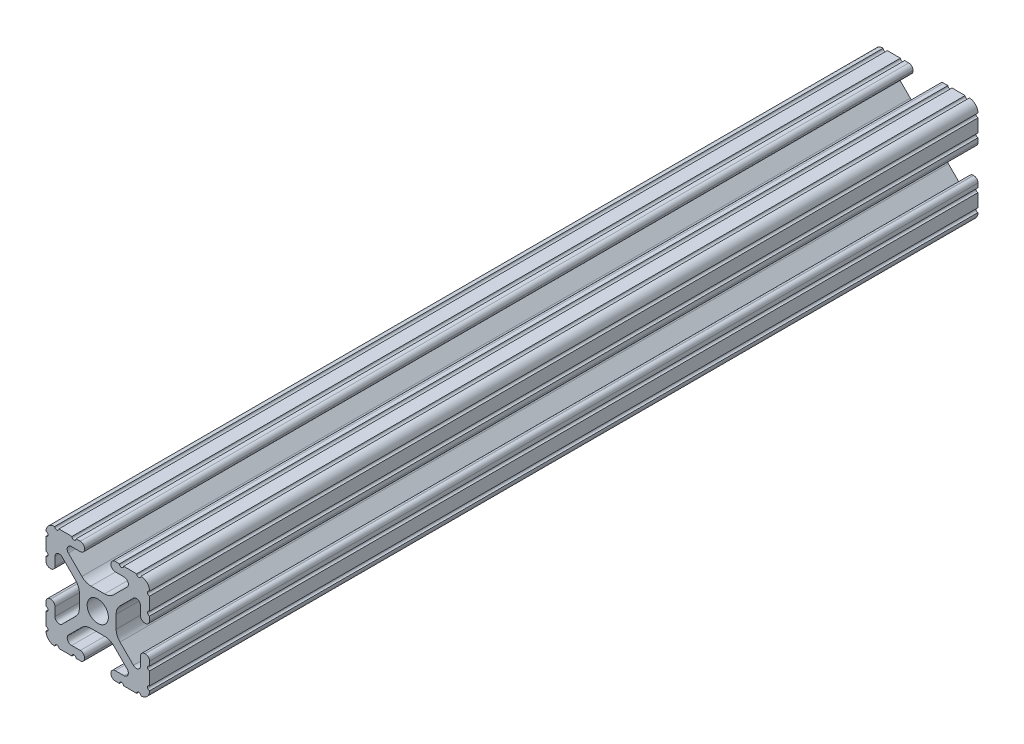
from build123d import *

# Parameters (mm, degrees)
SKETCH1_R      = 2.6035
EXTRUDE1_DEPTH = 203.2


with BuildPart() as part:
    # Sketch1 → Extrude1 (new body)
    with BuildSketch(Plane.XY):
        with BuildLine():
            Line((-7.207036008, 8.724370562), (-3.898272566, 5.423169045))
            ThreePointArc((-3.898272566, 5.423169045), (-2.869120213, 4.736787962), (-1.655778399, 4.4958))
            Line((-1.655778399, 4.4958), (1.655778399, 4.4958))
            ThreePointArc((1.655778399, 4.4958), (2.869120213, 4.736787962), (3.898272566, 5.423169045))
            Line((3.898272566, 5.423169045), (7.207036008, 8.724370562))
            ThreePointArc((7.207036008, 8.724370562), (7.432222385, 9.85140422), (6.476788598, 10.4902))
            Line((6.476788598, 10.4902), (4.287512407, 10.4902))
            ThreePointArc((4.287512407, 10.4902), (3.54574862, 10.79744862), (3.2385, 11.539212407))
            Line((3.2385, 11.539212407), (3.2385, 11.650987593))
            ThreePointArc((3.2385, 11.650987593), (3.54574862, 12.39275138), (4.287512407, 12.7))
            Line((4.287512407, 12.7), (5.317126718, 12.7))
            ThreePointArc((5.317126718, 12.7), (5.825126718, 12.192), (6.333126718, 12.7))
            Line((6.333126718, 12.7), (9.550443118, 12.7))
            ThreePointArc((9.550443118, 12.7), (10.058366869, 12.192000006), (10.566443095, 12.699847501))
            ThreePointArc((10.566443095, 12.699847501), (12.082537762, 12.08250727), (12.699846982, 10.566399977))
            ThreePointArc((12.699846982, 10.566399977), (12.192000006, 10.058323491), (12.7, 9.5504))
            Line((12.7, 9.5504), (12.7, 6.3330836))
            ThreePointArc((12.7, 6.3330836), (12.192, 5.8250836), (12.7, 5.3170836))
            Line((12.7, 5.3170836), (12.7, 4.287469289))
            ThreePointArc((12.7, 4.287469289), (12.39275138, 3.545705502), (11.650987593, 3.238456882))
            Line((11.650987593, 3.238456882), (11.539212407, 3.238456882))
            ThreePointArc((11.539212407, 3.238456882), (10.79744862, 3.545705502), (10.4902, 4.287469289))
            Line((10.4902, 4.287469289), (10.4902, 6.402089023))
            ThreePointArc((10.4902, 6.402089023), (9.856505071, 7.351067942), (8.737131347, 7.129408934))
            Line((8.737131347, 7.129408934), (5.441005833, 3.840816462))
            ThreePointArc((5.441005833, 3.840816462), (4.750877967, 2.809883091), (4.5085, 1.593185507))
            Line((4.5085, 1.593185507), (4.5085, -1.593185507))
            ThreePointArc((4.5085, -1.593185507), (4.750877967, -2.809883091), (5.441005833, -3.840816462))
            Line((5.441005833, -3.840816462), (8.737131347, -7.129408934))
            ThreePointArc((8.737131347, -7.129408934), (9.856505071, -7.351067942), (10.4902, -6.402089023))
            Line((10.4902, -6.402089023), (10.4902, -4.287469289))
            ThreePointArc((10.4902, -4.287469289), (10.79744862, -3.545705502), (11.539212407, -3.238456882))
            Line((11.539212407, -3.238456882), (11.650987593, -3.238456882))
            ThreePointArc((11.650987593, -3.238456882), (12.39275138, -3.545705502), (12.7, -4.287469289))
            Line((12.7, -4.287469289), (12.7, -5.3170836))
            ThreePointArc((12.7, -5.3170836), (12.192, -5.8250836), (12.7, -6.3330836))
            Line((12.7, -6.3330836), (12.7, -9.5504))
            ThreePointArc((12.7, -9.5504), (12.192000006, -10.058323491), (12.699846982, -10.566399977))
            ThreePointArc((12.699846982, -10.566399977), (12.082537762, -12.08250727), (10.566443095, -12.699847501))
            ThreePointArc((10.566443095, -12.699847501), (10.058366869, -12.192000006), (9.550443118, -12.7))
            Line((9.550443118, -12.7), (6.333126718, -12.7))
            ThreePointArc((6.333126718, -12.7), (5.825126718, -12.192), (5.317126718, -12.7))
            Line((5.317126718, -12.7), (4.287512407, -12.7))
            ThreePointArc((4.287512407, -12.7), (3.54574862, -12.39275138), (3.2385, -11.650987593))
            Line((3.2385, -11.650987593), (3.2385, -11.539212407))
            ThreePointArc((3.2385, -11.539212407), (3.54574862, -10.79744862), (4.287512407, -10.4902))
            Line((4.287512407, -10.4902), (6.416408329, -10.4902))
            ThreePointArc((6.416408329, -10.4902), (7.41473083, -9.822813117), (7.179650497, -8.645192506))
            Line((7.179650497, -8.645192506), (3.952270251, -5.423690499))
            ThreePointArc((3.952270251, -5.423690499), (2.922936451, -4.736929036), (1.709253557, -4.4958))
            Line((1.709253557, -4.4958), (-1.709253557, -4.4958))
            ThreePointArc((-1.709253557, -4.4958), (-2.922936451, -4.736929036), (-3.952270251, -5.423690499))
            Line((-3.952270251, -5.423690499), (-7.179650497, -8.645192506))
            ThreePointArc((-7.179650497, -8.645192506), (-7.41473083, -9.822813117), (-6.416408329, -10.4902))
            Line((-6.416408329, -10.4902), (-4.287512407, -10.4902))
            ThreePointArc((-4.287512407, -10.4902), (-3.54574862, -10.79744862), (-3.2385, -11.539212407))
            Line((-3.2385, -11.539212407), (-3.2385, -11.650987593))
            ThreePointArc((-3.2385, -11.650987593), (-3.54574862, -12.39275138), (-4.287512407, -12.7))
            Line((-4.287512407, -12.7), (-5.317126718, -12.7))
            ThreePointArc((-5.317126718, -12.7), (-5.825126718, -12.192), (-6.333126718, -12.7))
            Line((-6.333126718, -12.7), (-9.550443118, -12.7))
            ThreePointArc((-9.550443118, -12.7), (-10.058366869, -12.192000006), (-10.566443095, -12.699847501))
            ThreePointArc((-10.566443095, -12.699847501), (-12.082537762, -12.08250727), (-12.699846982, -10.566399977))
            ThreePointArc((-12.699846982, -10.566399977), (-12.192000006, -10.058323491), (-12.7, -9.5504))
            Line((-12.7, -9.5504), (-12.7, -6.3330836))
            ThreePointArc((-12.7, -6.3330836), (-12.192, -5.8250836), (-12.7, -5.3170836))
            Line((-12.7, -5.3170836), (-12.7, -4.287469289))
            ThreePointArc((-12.7, -4.287469289), (-12.39275138, -3.545705502), (-11.650987593, -3.238456882))
            Line((-11.650987593, -3.238456882), (-11.539212407, -3.238456882))
            ThreePointArc((-11.539212407, -3.238456882), (-10.79744862, -3.545705502), (-10.4902, -4.287469289))
            Line((-10.4902, -4.287469289), (-10.4902, -6.402089023))
            ThreePointArc((-10.4902, -6.402089023), (-9.856505071, -7.351067942), (-8.737131347, -7.129408934))
            Line((-8.737131347, -7.129408934), (-5.441005833, -3.840816462))
            ThreePointArc((-5.441005833, -3.840816462), (-4.750877967, -2.809883091), (-4.5085, -1.593185507))
            Line((-4.5085, -1.593185507), (-4.5085, 1.593185507))
            ThreePointArc((-4.5085, 1.593185507), (-4.750877967, 2.809883091), (-5.441005833, 3.840816462))
            Line((-5.441005833, 3.840816462), (-8.737131347, 7.129408934))
            ThreePointArc((-8.737131347, 7.129408934), (-9.856505071, 7.351067942), (-10.4902, 6.402089023))
            Line((-10.4902, 6.402089023), (-10.4902, 4.287469289))
            ThreePointArc((-10.4902, 4.287469289), (-10.79744862, 3.545705502), (-11.539212407, 3.238456882))
            Line((-11.539212407, 3.238456882), (-11.650987593, 3.238456882))
            ThreePointArc((-11.650987593, 3.238456882), (-12.39275138, 3.545705502), (-12.7, 4.287469289))
            Line((-12.7, 4.287469289), (-12.7, 5.3170836))
            ThreePointArc((-12.7, 5.3170836), (-12.192, 5.8250836), (-12.7, 6.3330836))
            Line((-12.7, 6.3330836), (-12.7, 9.5504))
            ThreePointArc((-12.7, 9.5504), (-12.192000006, 10.058323491), (-12.699846982, 10.566399977))
            ThreePointArc((-12.699846982, 10.566399977), (-12.082537762, 12.08250727), (-10.566443095, 12.699847501))
            ThreePointArc((-10.566443095, 12.699847501), (-10.058366869, 12.192000006), (-9.550443118, 12.7))
            Line((-9.550443118, 12.7), (-6.333126718, 12.7))
            ThreePointArc((-6.333126718, 12.7), (-5.825126718, 12.192), (-5.317126718, 12.7))
            Line((-5.317126718, 12.7), (-4.287512407, 12.7))
            ThreePointArc((-4.287512407, 12.7), (-3.54574862, 12.39275138), (-3.2385, 11.650987593))
            Line((-3.2385, 11.650987593), (-3.2385, 11.539212407))
            ThreePointArc((-3.2385, 11.539212407), (-3.54574862, 10.79744862), (-4.287512407, 10.4902))
            Line((-4.287512407, 10.4902), (-6.476788598, 10.4902))
            ThreePointArc((-6.476788598, 10.4902), (-7.432222385, 9.85140422), (-7.207036008, 8.724370562))
        make_face()
        Circle(SKETCH1_R, mode=Mode.SUBTRACT)
    extrude(amount=-EXTRUDE1_DEPTH)


solid = part.part
